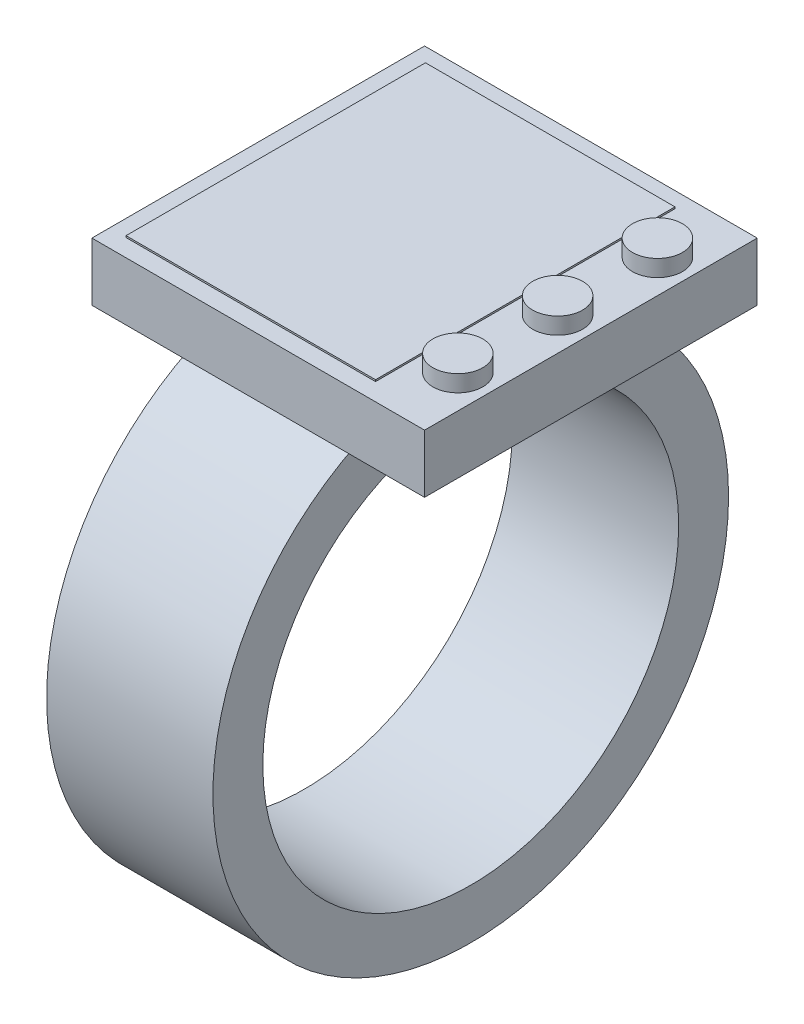
from build123d import *

# Parameters (mm, degrees)
SKETCH1_R           = 39.37
SKETCH1_R_2         = 31.75
BOSS_EXTRUDE1_DEPTH = 25.4
SKETCH4_W           = 50.8
SKETCH4_H           = 50.8
BOSS_EXTRUDE3_DEPTH = 8.89
SKETCH5_W           = 38.1
SKETCH5_H           = 45.72
BOSS_EXTRUDE4_DEPTH = 0.254
SKETCH7_R           = 3.81
BOSS_EXTRUDE5_DEPTH = 2.54


with BuildPart() as part:
    # Sketch1 → Boss-Extrude1 (new body)
    with BuildSketch(Plane(origin=(0, 0, 0), x_dir=(0, 0, -1), z_dir=(1, 0, 0))):
        Circle(SKETCH1_R)
        Circle(SKETCH1_R_2, mode=Mode.SUBTRACT)
    extrude(amount=BOSS_EXTRUDE1_DEPTH)


with BuildPart() as body_2:
    # Sketch4 → Boss-Extrude3 (new body)
    with BuildSketch(Plane(origin=(0, 39.37, 0), x_dir=(1, 0, 0), z_dir=(0, 1, 0))):
        with Locations((16.295414044, 2.050192216)):
            Rectangle(SKETCH4_W, SKETCH4_H)
    extrude(amount=BOSS_EXTRUDE3_DEPTH)

    # Sketch5 → Boss-Extrude4 (add)
    with BuildSketch(Plane(origin=(0, 48.26, 0), x_dir=(1, 0, 0), z_dir=(0, 1, 0))):
        with Locations((12.485414044, 2.184535296)):
            Rectangle(SKETCH5_W, SKETCH5_H)
    extrude(amount=BOSS_EXTRUDE4_DEPTH)

    # Sketch7 → Boss-Extrude5 (add)
    with BuildSketch(Plane(origin=(0, 48.26, 0), x_dir=(1, 0, 0), z_dir=(0, 1, 0))):
        with Locations(Location((36.615414044, 17.290192216, 0), (0, 0, 270))):
            Circle(SKETCH7_R)
        with Locations(Location((36.615414044, -13.189807784, 0), (0, 0, 270))):
            Circle(SKETCH7_R)
        with Locations(Location((36.615414044, 2.050192216, 0), (0, 0, 270))):
            Circle(SKETCH7_R)
    extrude(amount=BOSS_EXTRUDE5_DEPTH)


solid = Compound([part.part, body_2.part])
